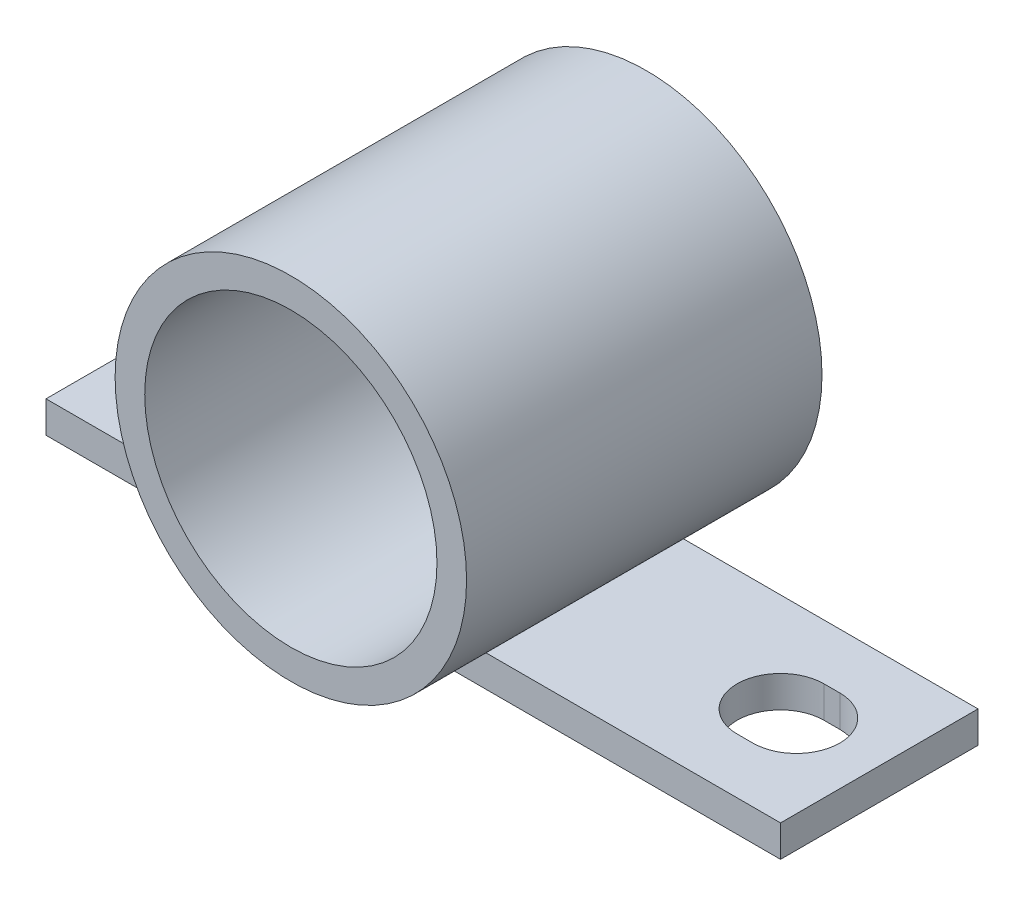
from build123d import *

# Parameters (mm, degrees)
SKETCH_1_W           = 93
SKETCH_1_H           = 25
EXTRUDE_1_DEPTH      = 4
EXTRUDE_2_DEPTH      = 15.5
EXTRUDE_2_DEPTH_BACK = 29.5
SKETCH_2_R           = 22.25
SKETCH_2_R_2         = 18.5


with BuildPart() as part:
    # Эскиз1 → Бобышка-Вытянуть1 (new body)
    with BuildSketch(Plane(origin=(0, 0, 0), x_dir=(1, 0, 0), z_dir=(0, 1, 0))):
        Rectangle(SKETCH_1_W, SKETCH_1_H)
        with BuildLine():
            Line((-36, 5.5), (-34, 5.5))
            ThreePointArc((-34, 5.5), (-28.5, 0), (-34, -5.5))
            Line((-34, -5.5), (-36, -5.5))
            ThreePointArc((-36, -5.5), (-41.5, 0), (-36, 5.5))
        make_face(mode=Mode.SUBTRACT)
        with BuildLine():
            Line((36, 5.5), (34, 5.5))
            ThreePointArc((34, 5.5), (28.5, 0), (34, -5.5))
            Line((34, -5.5), (36, -5.5))
            ThreePointArc((36, -5.5), (41.5, 0), (36, 5.5))
        make_face(mode=Mode.SUBTRACT)
    extrude(amount=EXTRUDE_1_DEPTH)


with BuildPart() as body_2:
    # Эскиз2 → Бобышка-Вытянуть2 (new, two sides: drawn at the far end of the back side and taken through both)
    with BuildSketch(Plane.XY.offset(12.5).offset(-EXTRUDE_2_DEPTH_BACK)):
        with Locations((0, 26.25)):
            Circle(SKETCH_2_R)
        with Locations((0, 26.25)):
            Circle(SKETCH_2_R_2, mode=Mode.SUBTRACT)
    extrude(amount=EXTRUDE_2_DEPTH + EXTRUDE_2_DEPTH_BACK)


solid = Compound([part.part, body_2.part])
